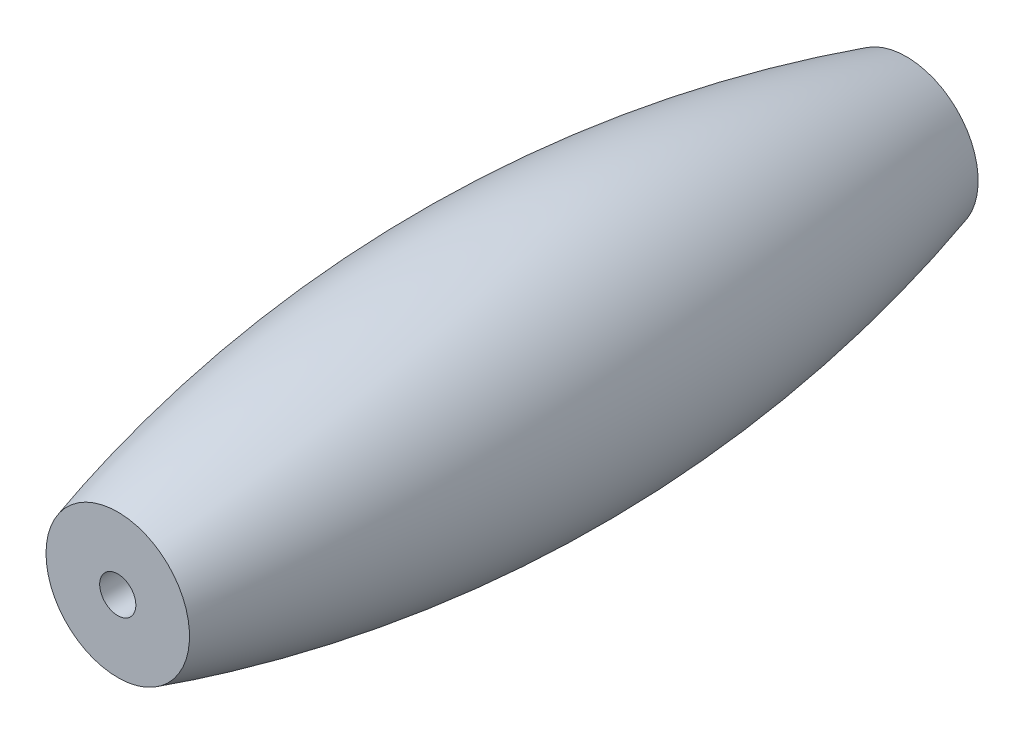
from build123d import *

# Parameters (mm, degrees)
SKETCH_2_R          = 1.25
CUT_EXTRUDE_1_DEPTH = 56.917530471


with BuildPart() as part:
    # 草图1 → 旋转1 (revolve)
    with BuildSketch(Plane(origin=(0, 0, 0), x_dir=(1, 0, 0), z_dir=(0, 1, 0)), mode=Mode.PRIVATE) as revolve_1_sk:
        with BuildLine():
            Line((0, 27.25), (0, -27.25))
            Line((0, -27.25), (4.958896984, -27.25))
            ThreePointArc((4.958896984, -27.25), (8.846473862, 0), (4.958896984, 27.25))
            Line((4.958896984, 27.25), (0, 27.25))
        make_face()
    revolve(revolve_1_sk.sketch.rotate(Axis((0, 0, -27.25), (0, 0, 1)), 180), axis=Axis((0, 0, -27.25), (0, 0, 1)))

    # 草图2 → 切除-拉伸1 (cut, through all)
    with BuildSketch(Plane.XY.offset(27.25)):
        Circle(SKETCH_2_R)
    extrude(amount=-CUT_EXTRUDE_1_DEPTH, mode=Mode.SUBTRACT)


solid = part.part
